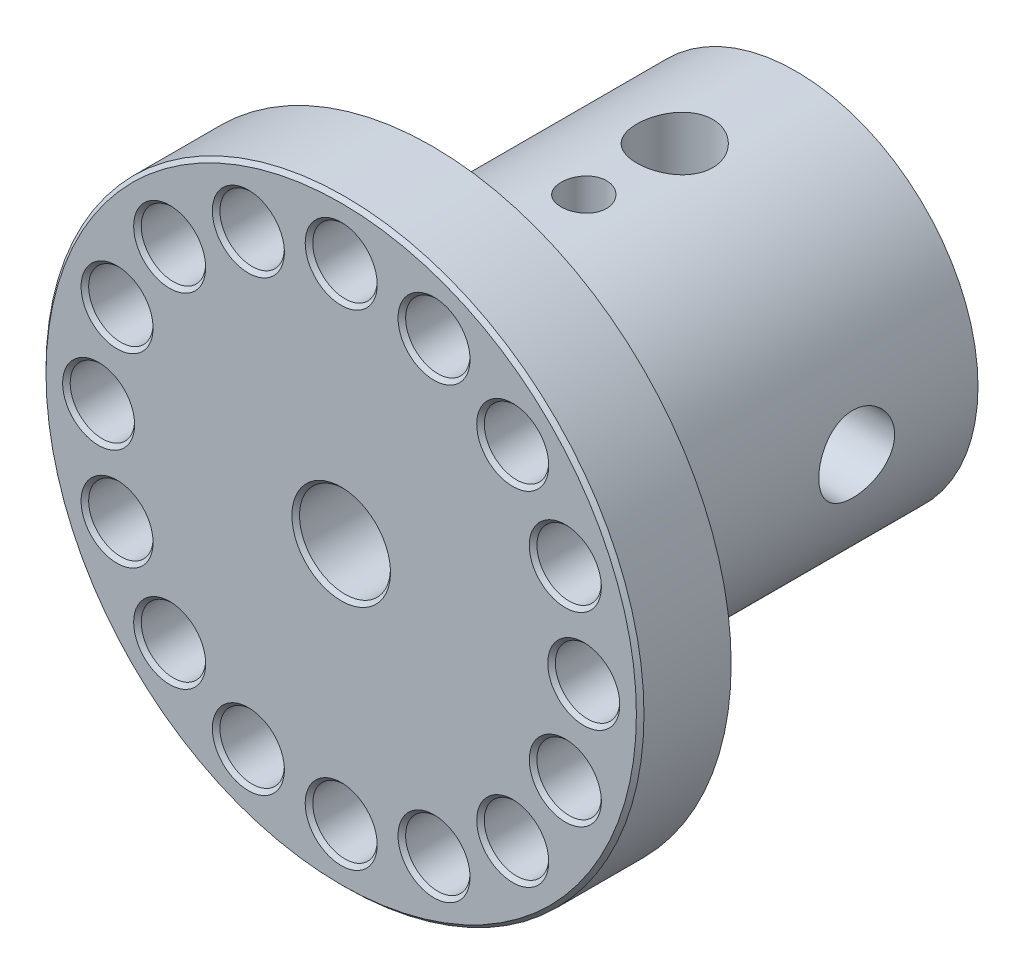
from build123d import *

# Parameters (mm, degrees)
SKETCH2_R          = 3.3734375
CUT_EXTRUDE1_DEPTH = 66.024682125
CIRPATTERN1_COUNT  = 16
SKETCH4_R          = 2.38125
CUT_EXTRUDE2_DEPTH = 66.024682125
CUT_EXTRUDE3_DEPTH = 22.225
SKETCH5_R          = 3.96875
CUT_EXTRUDE4_DEPTH = 66.024682199
CIRPATTERN2_COUNT  = 2
CIRPATTERN2_ANGLE  = 90
CHAMFER1_SIZE      = 0.396875


with BuildPart() as part:
    # Sketch1 → Base-Revolve (revolve)
    with BuildSketch(Plane(origin=(0, 0, 0), x_dir=(0, 0, -1), z_dir=(1, 0, 0)), mode=Mode.PRIVATE) as base_revolve_sk:
        with BuildLine():
            Line((0, 31.3055), (0, 4.7625))
            Line((0, 4.7625), (19.05, 4.7625))
            Line((19.05, 4.7625), (19.05, 3.96875))
            Line((19.05, 3.96875), (25.4, 3.96875))
            Line((25.4, 3.96875), (25.4, 7.0231))
            Line((25.4, 7.0231), (47.625, 7.0231))
            Line((47.625, 7.0231), (47.625, 19.05))
            Line((47.625, 19.05), (12.7, 19.05))
            ThreePointArc((12.7, 19.05), (10.45493597, 19.97993597), (9.525, 22.225))
            Line((9.525, 22.225), (9.525, 31.3055))
            Line((9.525, 31.3055), (0, 31.3055))
        make_face()
    revolve(base_revolve_sk.sketch.rotate(Axis((0, 0, 8.5328125), (0, 0, -1)), 90), axis=Axis((0, 0, 8.5328125), (0, 0, -1)))

    # Sketch2 → Cut-Extrude1 (cut, through all)
    with BuildSketch(Plane.XY):
        with Locations((25.4, 0)):
            Circle(SKETCH2_R)
    cut_extrude1 = extrude(amount=-CUT_EXTRUDE1_DEPTH, mode=Mode.SUBTRACT)

    # CirPattern1: Cut-Extrude1 ×16 about axis
    cirpattern1_axis = Axis((0, 0, 0), (0, 0, 1))
    for i in range(1, CIRPATTERN1_COUNT):
        add(cut_extrude1.rotate(cirpattern1_axis, i * 360 / CIRPATTERN1_COUNT), mode=Mode.SUBTRACT)

    # Sketch4 → Cut-Extrude2 (cut, through all)
    with BuildSketch(Plane(origin=(0, 0, 0), x_dir=(1, 0, 0), z_dir=(0, 1, 0))):
        with Locations(Location((0, 25.4, 0), (0, 0, 90))):
            Circle(SKETCH4_R)
    extrude(amount=CUT_EXTRUDE2_DEPTH, mode=Mode.SUBTRACT)

    # Sketch3 → Cut-Extrude3 (cut)
    with BuildSketch(Plane(origin=(0, 0, -47.625), x_dir=(-1, 0, 0), z_dir=(0, 0, -1))):
        with BuildLine():
            Line((-2.54, 9.3599), (2.54, 9.3599))
            Line((2.54, 9.3599), (2.54, 6.547696817))
            ThreePointArc((2.54, 6.547696817), (0, 7.0231), (-2.54, 6.547696817))
            Line((-2.54, 6.547696817), (-2.54, 9.3599))
        make_face()
    extrude(amount=-CUT_EXTRUDE3_DEPTH, mode=Mode.SUBTRACT)

    # Sketch5 → Cut-Extrude4 (cut, through all)
    with BuildSketch(Plane(origin=(0, 0, 0), x_dir=(1, 0, 0), z_dir=(0, 1, 0))):
        with Locations(Location((0, 34.925, 0), (0, 0, 90))):
            Circle(SKETCH5_R)
    cut_extrude4 = extrude(amount=CUT_EXTRUDE4_DEPTH, mode=Mode.SUBTRACT)

    # CirPattern2: Cut-Extrude4 ×2 about axis
    cirpattern2_axis = Axis((0, 0, -41.4671875), (0, 0, -1))
    for i in range(1, CIRPATTERN2_COUNT):
        add(cut_extrude4.rotate(cirpattern2_axis, i * CIRPATTERN2_ANGLE / (CIRPATTERN2_COUNT - 1)), mode=Mode.SUBTRACT)

    # Chamfer1
    chamfer1_edges = [part.edges().sort_by_distance(p)[0] for p in [
        (8.429200541, -20.349890265, 0),
        (15.57513171, -15.57513171, 0),
        (20.349890265, -8.429200541, 0),
        (-4.7625, 0, 0),
        (-31.3055, 0, 0),
        (22.0265625, 0, 0),
        (20.349890265, 8.429200541, 0),
        (15.57513171, 15.57513171, 0),
        (8.429200541, 20.349890265, 0),
        (0, 22.0265625, 0),
        (-8.429200541, 20.349890265, 0),
        (-15.57513171, 15.57513171, 0),
        (-20.349890265, 8.429200541, 0),
        (-22.0265625, 0, 0),
        (-20.349890265, -8.429200541, 0),
        (-15.57513171, -15.57513171, 0),
        (-8.429200541, -20.349890265, 0),
        (0, -22.0265625, 0),
    ]]
    chamfer(chamfer1_edges, length=CHAMFER1_SIZE)


solid = part.part
